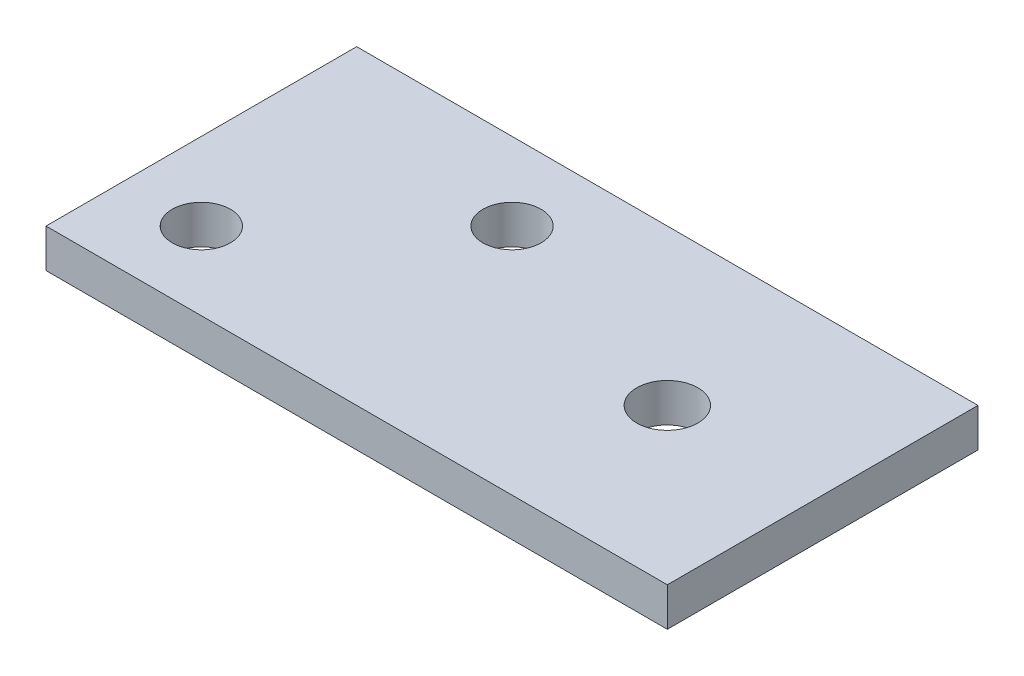
from build123d import *

# Parameters (mm, degrees)
CROQUIS1_W              = 101.6
CROQUIS1_H              = 50.8
SALIENTE_EXTRUIR1_DEPTH = 6.31
CROQUIS2_R              = 4.7625
CORTAR_EXTRUIR1_DEPTH   = 6.31
CROQUIS3_R              = 5
CORTAR_EXTRUIR2_DEPTH   = 10


with BuildPart() as part:
    # Croquis1 → Saliente-Extruir1 (new body)
    with BuildSketch(Plane(origin=(0, 0, 0), x_dir=(1, 0, 0), z_dir=(0, 1, 0))):
        Rectangle(CROQUIS1_W, CROQUIS1_H)
    extrude(amount=SALIENTE_EXTRUIR1_DEPTH)

    # Croquis2 → Cortar-Extruir1 (cut)
    with BuildSketch(Plane(origin=(0, 6.31, 0), x_dir=(1, 0, 0), z_dir=(0, 1, 0))):
        with Locations(Location((-38.1, -12.7, 0), (0, 0, 270))):
            Circle(CROQUIS2_R)
        with Locations(Location((-12.7, 12.7, 0), (0, 0, 270))):
            Circle(CROQUIS2_R)
    extrude(amount=-CORTAR_EXTRUIR1_DEPTH, mode=Mode.SUBTRACT)

    # Croquis3 → Cortar-Extruir2 (cut)
    with BuildSketch(Plane(origin=(0, 6.31, 0), x_dir=(1, 0, 0), z_dir=(0, 1, 0))):
        with Locations(Location((25.4, 0, 0), (0, 0, 270))):
            Circle(CROQUIS3_R)
    extrude(amount=-CORTAR_EXTRUIR2_DEPTH, mode=Mode.SUBTRACT)


solid = part.part
